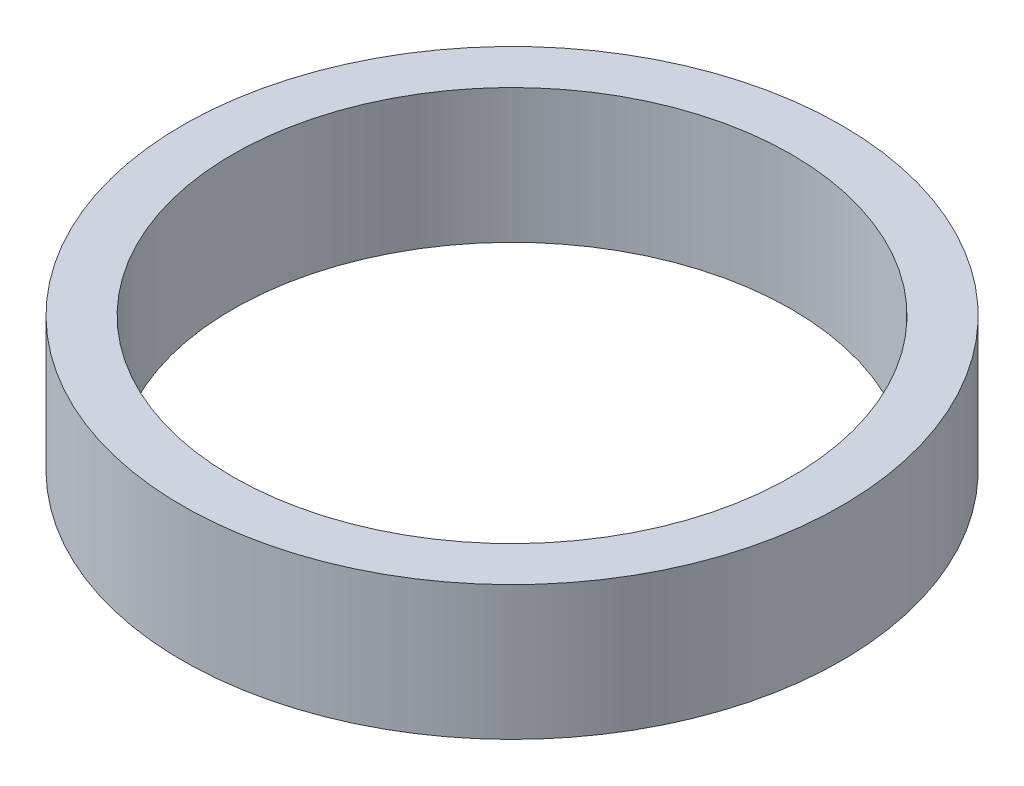
from build123d import *

# Parameters (mm, degrees)
SKETCH_1_W = 4.5
SKETCH_1_H = 12


with BuildPart() as part:
    # Эскиз1 → Повернуть1 (revolve)
    with BuildSketch(Plane.XY, mode=Mode.PRIVATE) as revolve_1_sk:
        with Locations((-27.25, 6)):
            Rectangle(SKETCH_1_W, SKETCH_1_H)
    revolve(revolve_1_sk.sketch.rotate(Axis((0, 0, 0), (0, 1, 0)), 270), axis=Axis((0, 0, 0), (0, 1, 0)))


solid = part.part
